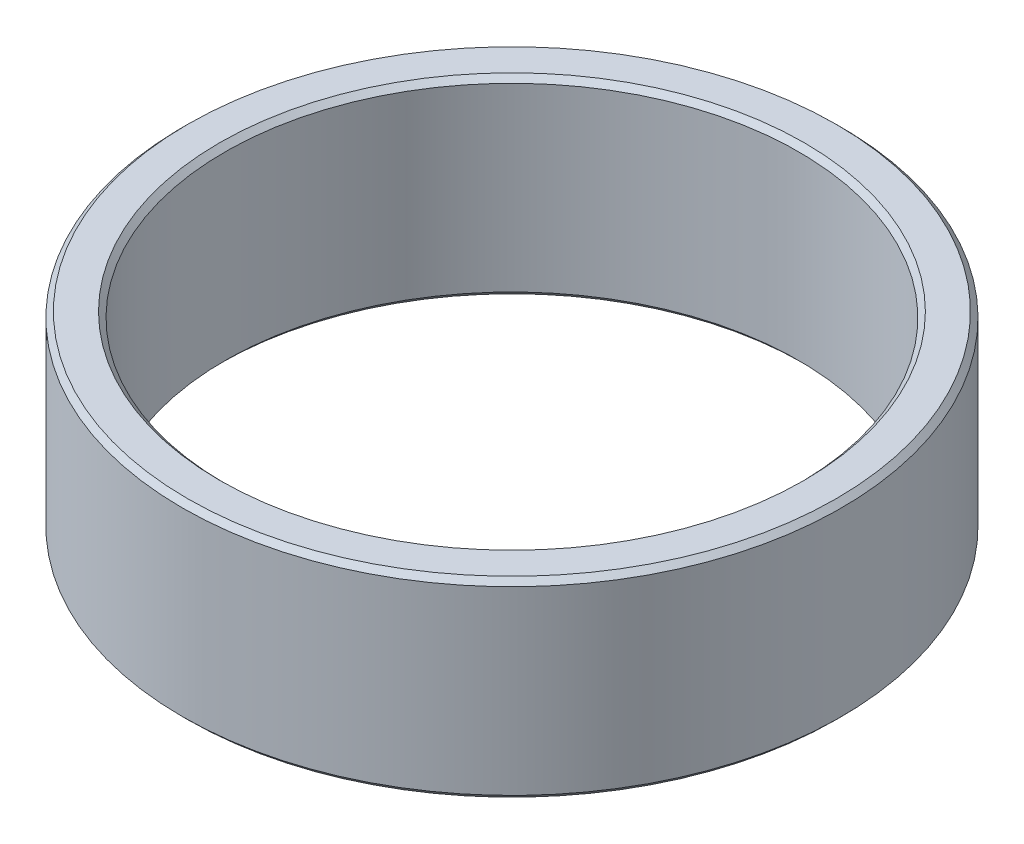
from build123d import *

# Parameters (mm, degrees)
SCHIZZO1_R        = 31
SCHIZZO1_R_2      = 27
ESTRUSIONE1_DEPTH = 18
SMUSSO1_SIZE      = 0.5


with BuildPart() as part:
    # Schizzo1 → Estrusione1 (new body)
    with BuildSketch(Plane(origin=(0, 0, 0), x_dir=(1, 0, 0), z_dir=(0, 1, 0))):
        with Locations(Location((0, 0, 0), (0, 0, 270))):
            Circle(SCHIZZO1_R)
        with Locations(Location((0, 0, 0), (0, 0, 270))):
            Circle(SCHIZZO1_R_2, mode=Mode.SUBTRACT)
    extrude(amount=ESTRUSIONE1_DEPTH)

    # Smusso1
    smusso1_edges = [part.edges().sort_by_distance(p)[0] for p in [
        (0, 0, -31),
        (0, 18, -31),
        (0, 0, -27),
        (0, 18, -27),
    ]]
    chamfer(smusso1_edges, length=SMUSSO1_SIZE)


solid = part.part
